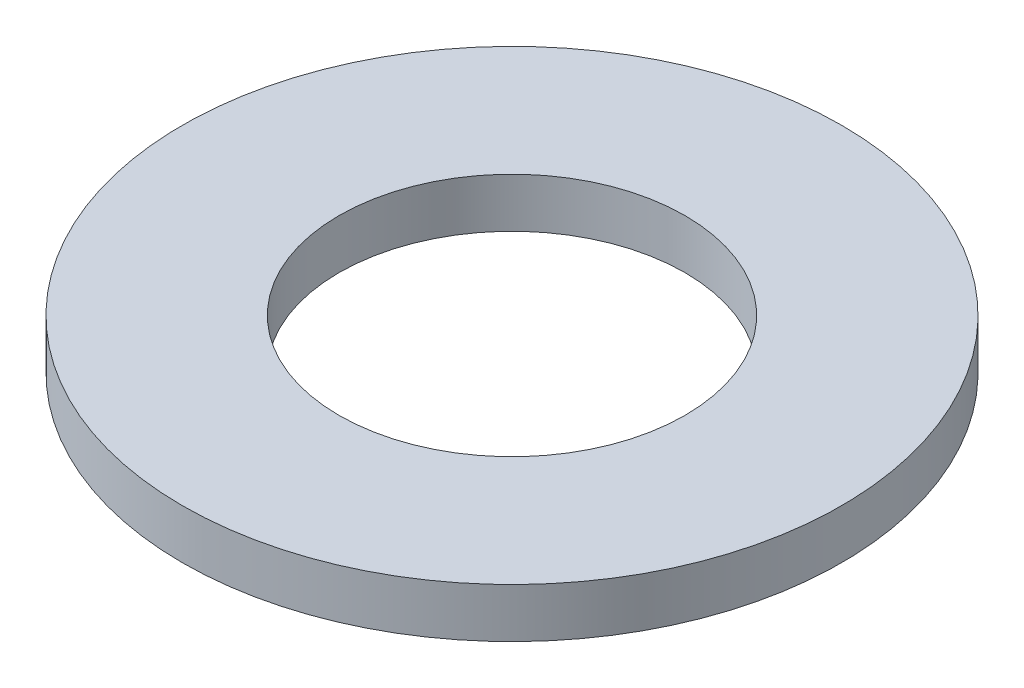
from build123d import *

# Parameters (mm, degrees)
SKETCH_1_R      = 4
SKETCH_1_R_2    = 2.1
EXTRUDE_1_DEPTH = 0.6


with BuildPart() as part:
    # 草图1 → 凸台-拉伸1 (new body)
    with BuildSketch(Plane(origin=(0, 0, 0), x_dir=(1, 0, 0), z_dir=(0, 1, 0))):
        with Locations(Location((0, 0, 0), (0, 0, 270))):
            Circle(SKETCH_1_R)
        with Locations(Location((0, 0, 0), (0, 0, 270))):
            Circle(SKETCH_1_R_2, mode=Mode.SUBTRACT)
    extrude(amount=EXTRUDE_1_DEPTH)


solid = part.part
